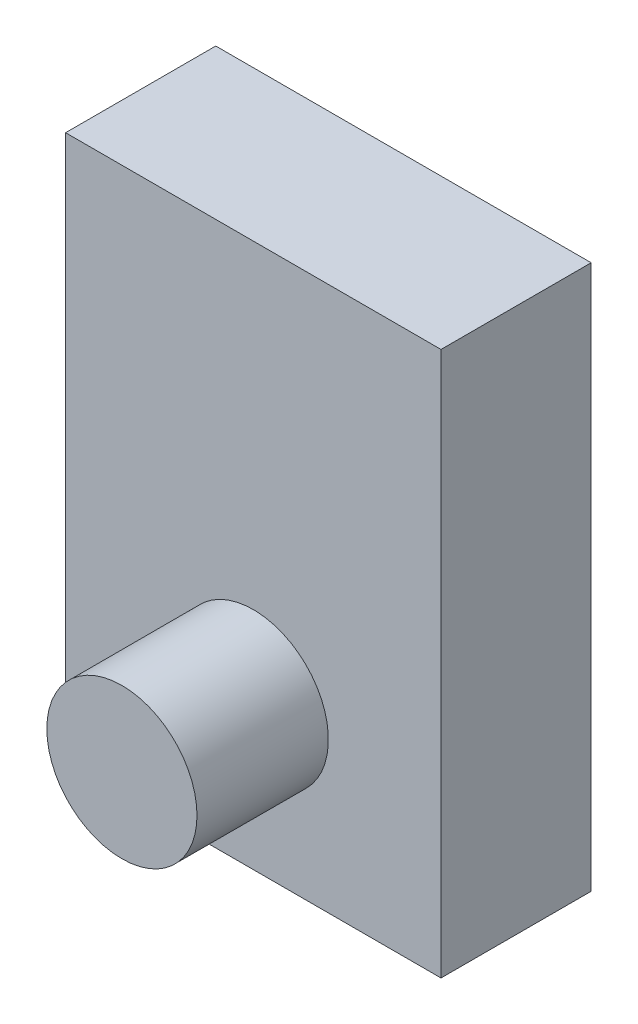
from build123d import *

# Parameters (mm, degrees)
SK_P01_HANGER_W       = 20
SK_P01_HANGER_H       = 8
P01_HANGER_DEPTH      = 29
P02_PIVOTPIN8MM_START = -8.5
SK_P02_PIVOTPIN8MM_R  = 4
P02_PIVOTPIN8MM_DEPTH = 17


with BuildPart() as part:
    # SK_P01_Hanger → P01_Hanger (new body)
    with BuildSketch(Plane(origin=(0, 0, 0), x_dir=(1, 0, 0), z_dir=(0, 1, 0))):
        with Locations((0, 2.5)):
            Rectangle(SK_P01_HANGER_W, SK_P01_HANGER_H)
    extrude(amount=P01_HANGER_DEPTH)

    # SK_P02_Pivotpin8mm → P02_Pivotpin8mm (add)
    with BuildSketch(Plane.XY.offset(P02_PIVOTPIN8MM_START)):
        with Locations((0, 8)):
            Circle(SK_P02_PIVOTPIN8MM_R)
    extrude(amount=P02_PIVOTPIN8MM_DEPTH)


solid = part.part
